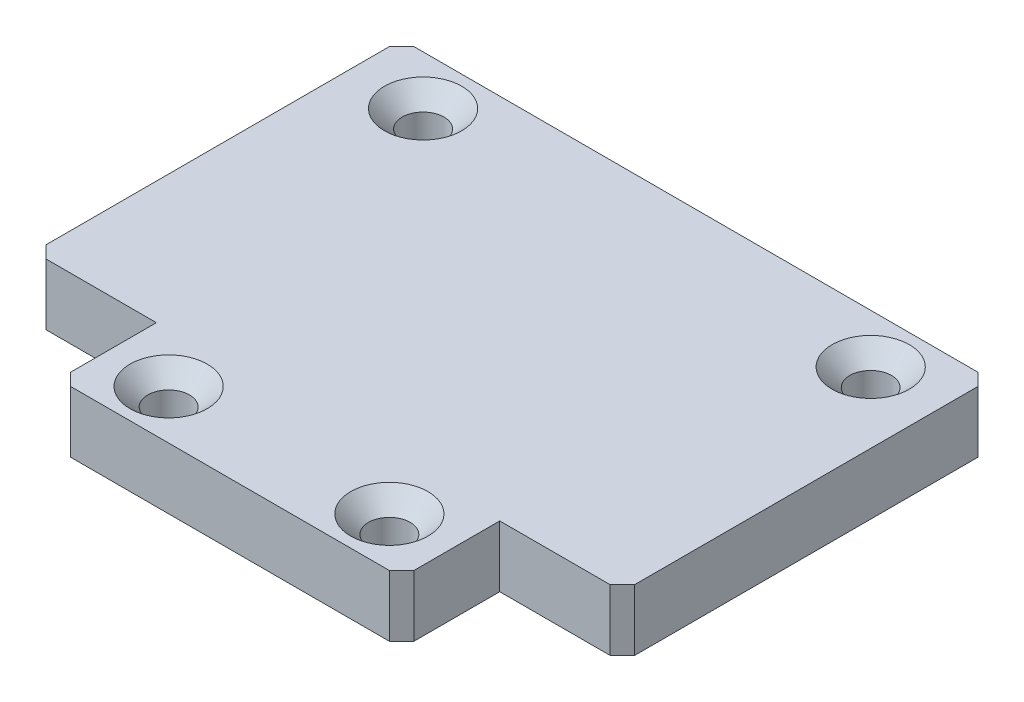
from build123d import *

# Parameters (mm, degrees)
BOSS_EXTRUDE1_DEPTH                                 = 5
CSK_FOR_M3_FLAT_COUNTERSUNK_HEAD_SCREW1_D           = 3.4
CSK_FOR_M3_FLAT_COUNTERSUNK_HEAD_SCREW1_CSINK_D     = 6.3
CSK_FOR_M3_FLAT_COUNTERSUNK_HEAD_SCREW1_CSINK_ANGLE = 90
CHAMFER1_SIZE                                       = 1


with BuildPart() as part:
    # Sketch1 → Boss-Extrude1 (new body)
    with BuildSketch(Plane(origin=(0, 0, 0), x_dir=(1, 0, 0), z_dir=(0, 1, 0))):
        Polygon((0, 0), (0, 30), (48, 30), (48, 0), (38, 0), (38, -8), (10, -8), (10, 0), align=None)
    extrude(amount=BOSS_EXTRUDE1_DEPTH)

    # CSK for M3 Flat Countersunk Head Screw1 (through all)
    with Locations(Plane(origin=(0, 5, 0), x_dir=(1, 0, 0), z_dir=(0, 1, 0))):
        with Locations((5.75, 26), (42.25, 26), (15, -4), (33, -4)):
            CounterSinkHole(CSK_FOR_M3_FLAT_COUNTERSUNK_HEAD_SCREW1_D / 2, CSK_FOR_M3_FLAT_COUNTERSUNK_HEAD_SCREW1_CSINK_D / 2, counter_sink_angle=CSK_FOR_M3_FLAT_COUNTERSUNK_HEAD_SCREW1_CSINK_ANGLE)

    # Chamfer1
    chamfer1_edges = [part.edges().sort_by_distance(p)[0] for p in [
        (0, 2.5, 0),
        (0, 2.5, -30),
        (48, 2.5, -30),
        (48, 2.5, 0),
        (38, 2.5, 8),
        (10, 2.5, 8),
    ]]
    chamfer(chamfer1_edges, length=CHAMFER1_SIZE)


solid = part.part
